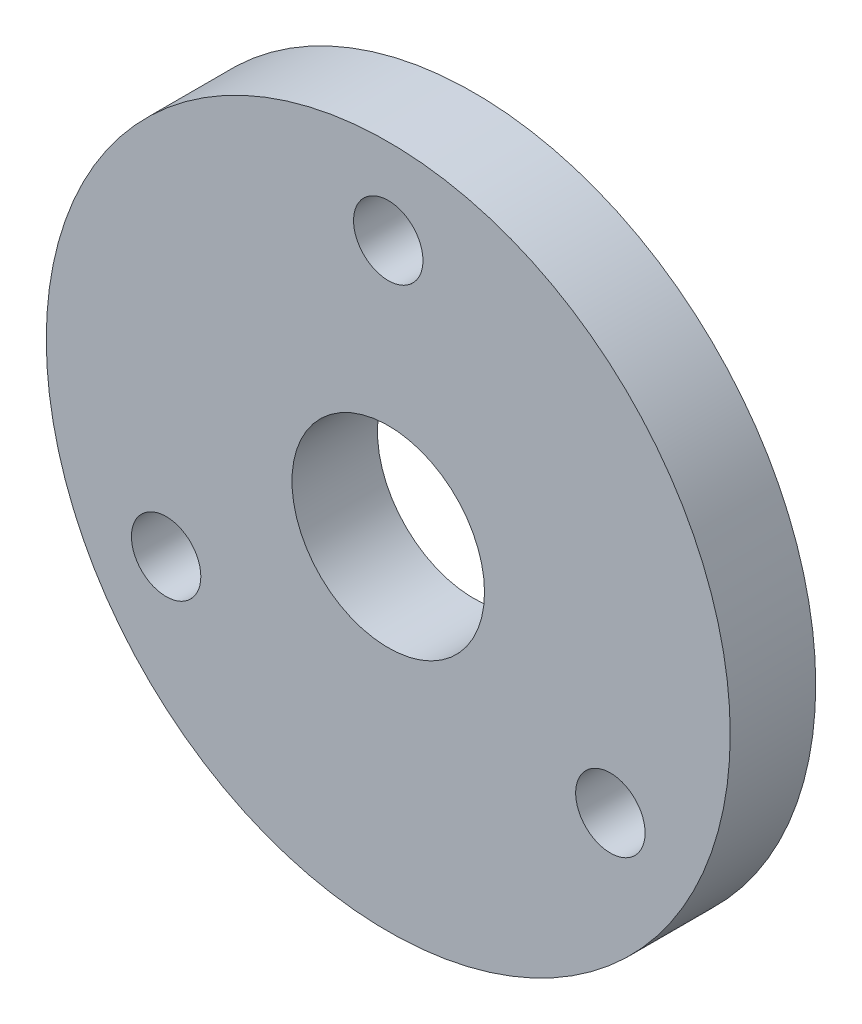
from build123d import *

# Parameters (mm, degrees)
SKETCH1_R           = 25.4
BOSS_EXTRUDE1_DEPTH = 6.35
SKETCH1_3_R         = 2.5781
CUT_EXTRUDE1_DEPTH  = 6.35
SKETCH1_5_R         = 7.1501
CUT_EXTRUDE2_DEPTH  = 6.35


with BuildPart() as part:
    # Sketch1 → Boss-Extrude1 (new body)
    with BuildSketch(Plane.XY):
        Circle(SKETCH1_R)
    extrude(amount=BOSS_EXTRUDE1_DEPTH)

    # Sketch1<3> → Cut-Extrude1 (cut)
    with BuildSketch(Plane.XY):
        with Locations((0, 19.05)):
            Circle(SKETCH1_3_R)
        with Locations((16.497783942, -9.525)):
            Circle(SKETCH1_3_R)
        with Locations((-16.497783942, -9.525)):
            Circle(SKETCH1_3_R)
    extrude(amount=CUT_EXTRUDE1_DEPTH, mode=Mode.SUBTRACT)

    # Sketch1<5> → Cut-Extrude2 (cut)
    with BuildSketch(Plane.XY):
        Circle(SKETCH1_5_R)
    extrude(amount=CUT_EXTRUDE2_DEPTH, mode=Mode.SUBTRACT)


solid = part.part
